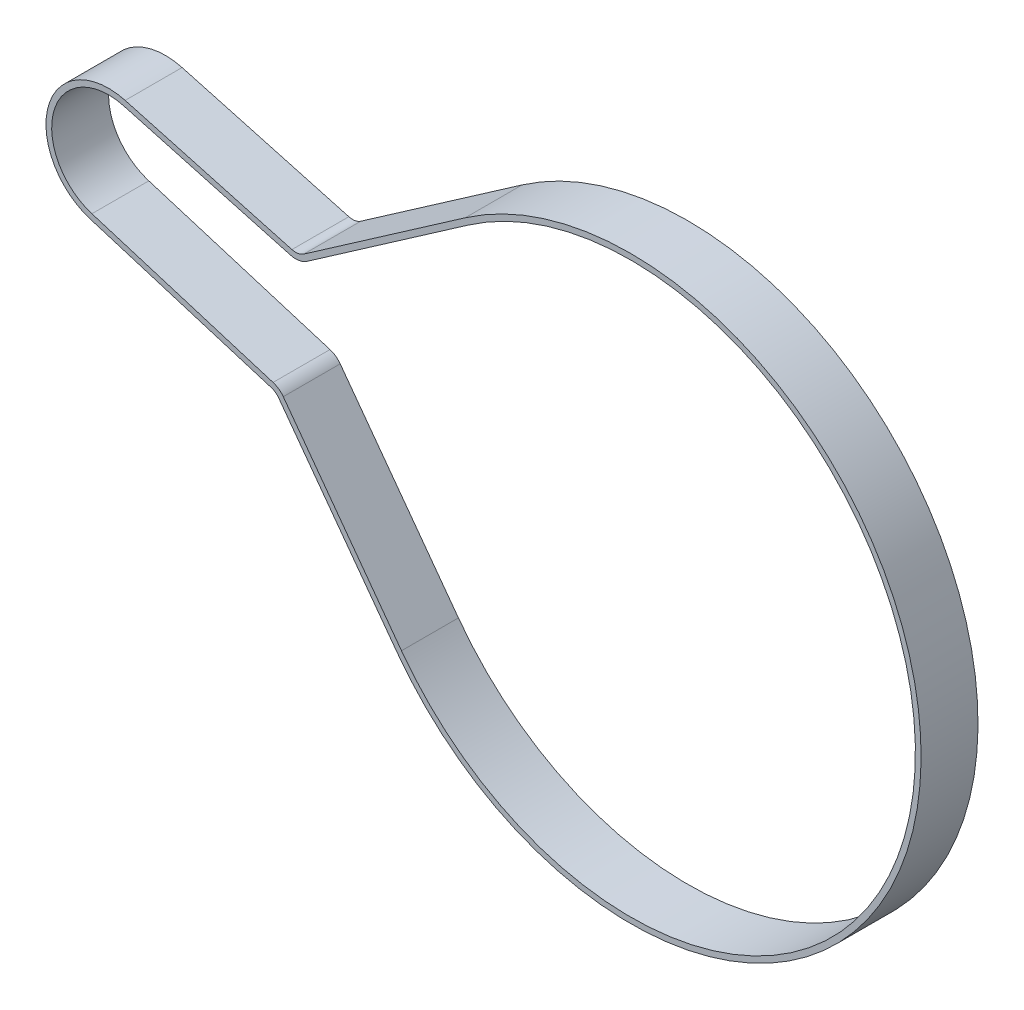
from build123d import *

# Parameters (mm, degrees)
EXTRUDE_THIN1_DEPTH = 10


with BuildPart() as part:
    # Sketch2 → Extrude-Thin1 (new body)
    with BuildSketch(Plane.XY):
        with BuildLine():
            Line((-61.870992291, -1.915838758), (-41.104249143, -30.190076223))
            ThreePointArc((-41.104249143, -30.190076223), (50.306930752, -8.379302973), (-29.099423566, 41.88345196))
            Line((-29.099423566, 41.88345196), (-57.459464133, 22.179707541))
            ThreePointArc((-57.459464133, 22.179707541), (-58.464037946, 21.768669609), (-59.548133687, 21.822121952))
            Line((-59.548133687, 21.822121952), (-88.84671512, 29.870552095))
            ThreePointArc((-88.84671512, 29.870552095), (-102.323910379, 22.331824169), (-94.982729961, 8.746012422))
            Line((-94.982729961, 8.746012422), (-63.153584859, -1.005408691))
            ThreePointArc((-63.153584859, -1.005408691), (-62.438824286, -1.357128953), (-61.870992291, -1.915838758))
        make_face()
        with BuildLine():
            Line((-61.065026622, -1.323876479), (-40.298283474, -29.598113945))
            ThreePointArc((-40.298283474, -29.598113945), (49.320520345, -8.215002915), (-28.528846634, 41.062207804))
            Line((-28.528846634, 41.062207804), (-56.8888872, 21.358463385))
            ThreePointArc((-56.8888872, 21.358463385), (-58.295290539, 20.783010281), (-59.813024576, 20.85784356))
            Line((-59.813024576, 20.85784356), (-89.111606009, 28.906273703))
            ThreePointArc((-89.111606009, 28.906273703), (-101.363601699, 22.05288468), (-94.689801318, 9.702146727))
            Line((-94.689801318, 9.702146727), (-62.860656217, -0.049274385))
            ThreePointArc((-62.860656217, -0.049274385), (-61.859991414, -0.541682752), (-61.065026622, -1.323876479))
        make_face(mode=Mode.SUBTRACT)
    extrude(amount=-EXTRUDE_THIN1_DEPTH)


solid = part.part
